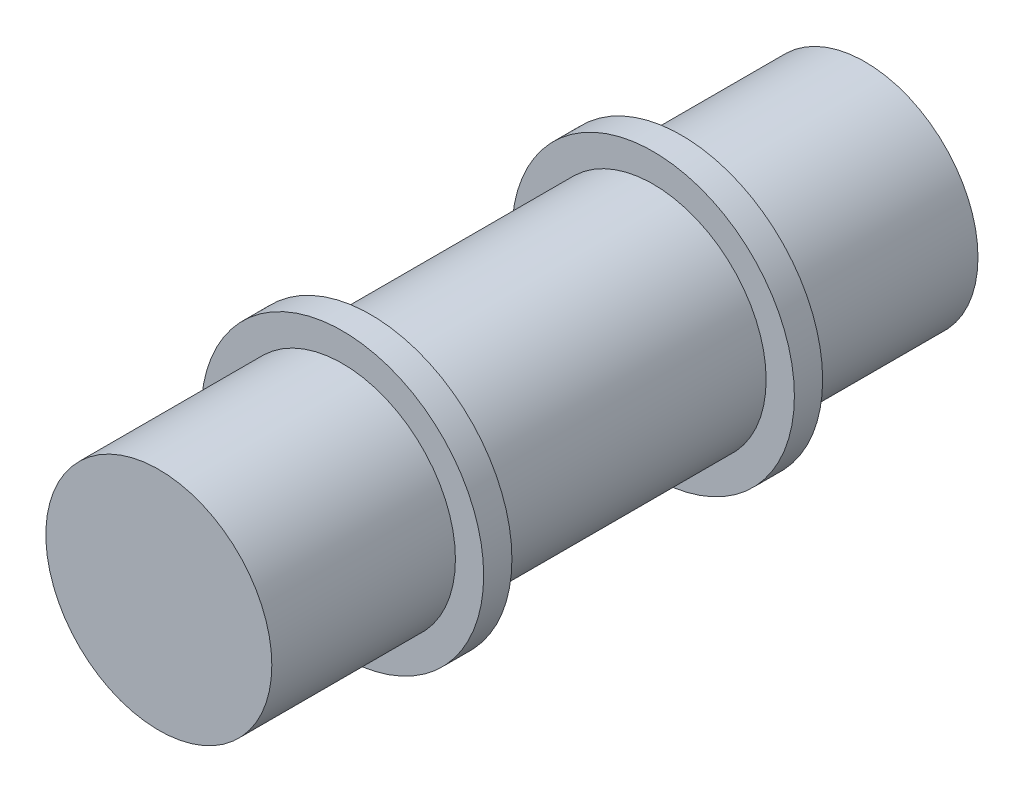
from build123d import *

# Parameters (mm, degrees)
SKETCH1_R           = 10
BOSS_EXTRUDE1_DEPTH = 50
SKETCH2_W           = 13
SKETCH2_H           = 2
SKETCH2_W_2         = 20


with BuildPart() as part:
    # Sketch1 → Boss-Extrude1 (new body)
    with BuildSketch(Plane.XY):
        Circle(SKETCH1_R)
    extrude(amount=BOSS_EXTRUDE1_DEPTH)

    # Sketch2 → Cut-Revolve1 (revolve, cut)
    with BuildSketch(Plane(origin=(0, 0, 0), x_dir=(0, 0, -1), z_dir=(1, 0, 0)), mode=Mode.PRIVATE) as cut_revolve1_sk:
        with Locations((-43.5, 9)):
            Rectangle(SKETCH2_W, SKETCH2_H)
        with Locations((-25, 9)):
            Rectangle(SKETCH2_W_2, SKETCH2_H)
        with Locations((-6.5, 9)):
            Rectangle(SKETCH2_W, SKETCH2_H)
    revolve(cut_revolve1_sk.sketch.rotate(Axis((0, 0, 25), (0, 0, -1)), 90), axis=Axis((0, 0, 25), (0, 0, -1)), mode=Mode.SUBTRACT)


solid = part.part
